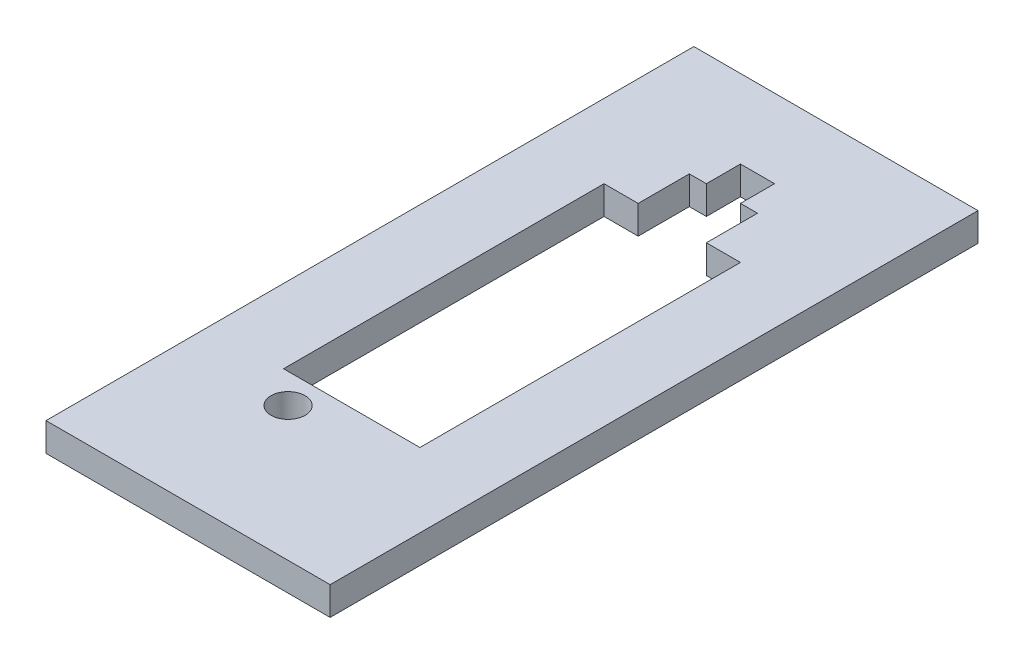
from build123d import *

# Parameters (mm, degrees)
SKETCH1_W           = 31.75
SKETCH1_H           = 72.39
BOSS_EXTRUDE1_DEPTH = 3.175
SKETCH3_W           = 15.24
SKETCH3_H           = 35.814
CUT_EXTRUDE1_DEPTH  = 3.175
SKETCH4_W           = 3.81
SKETCH4_H           = 3.81
SKETCH4_R           = 1.905
CUT_EXTRUDE9_DEPTH  = 3.175


with BuildPart() as part:
    # Sketch1 → Boss-Extrude1 (new body)
    with BuildSketch(Plane(origin=(0, 0, 0), x_dir=(1, 0, 0), z_dir=(0, 1, 0))):
        Rectangle(SKETCH1_W, SKETCH1_H)
    extrude(amount=BOSS_EXTRUDE1_DEPTH)

    # Sketch3 → Cut-Extrude1 (cut)
    with BuildSketch(Plane(origin=(0, 3.175, 0), x_dir=(1, 0, 0), z_dir=(0, 1, 0))):
        Rectangle(SKETCH3_W, SKETCH3_H)
    extrude(amount=-CUT_EXTRUDE1_DEPTH, mode=Mode.SUBTRACT)

    # Sketch4 → Cut-Extrude9 (cut)
    with BuildSketch(Plane(origin=(0, 3.175, 0), x_dir=(1, 0, 0), z_dir=(0, 1, 0))):
        Polygon((-3.81, 23.622), (-3.81, 17.907), (3.81, 17.907), (3.81, 23.622), (1.905, 23.622), (-1.905, 23.622), align=None)
        with Locations((0, 25.527)):
            Rectangle(SKETCH4_W, SKETCH4_H)
        with Locations(Location((-3.81, -21.209, 0), (0, 0, 270))):
            Circle(SKETCH4_R)
    extrude(amount=-CUT_EXTRUDE9_DEPTH, mode=Mode.SUBTRACT)


solid = part.part
